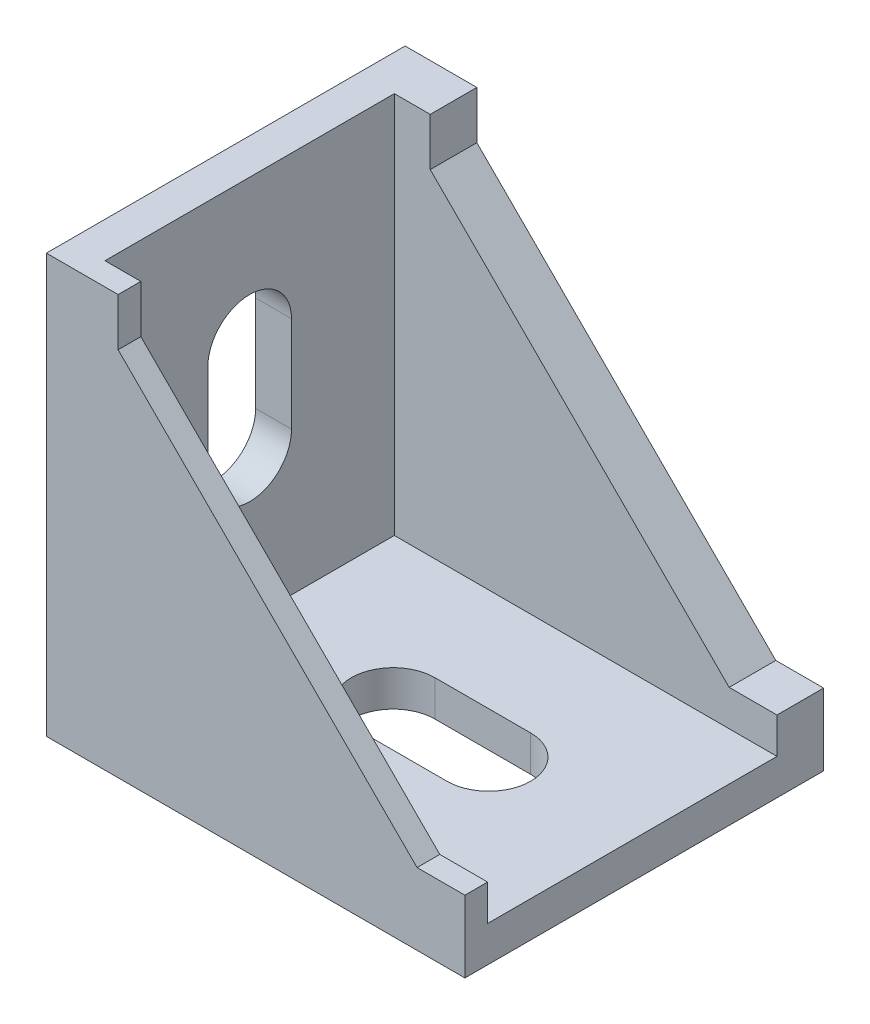
from build123d import *

# Parameters (mm, degrees)
BOSS_EXTRUDE1_DEPTH     = 15
CUT_EXTRUDE1_START      = -7
CUT_EXTRUDE1_DEPTH      = 6.05
CUT_EXTRUDE2_DEPTH      = 29.057975693
CUT_EXTRUDE2_DEPTH_BACK = 29.057975693
CUT_EXTRUDE3_DEPTH      = 29.057975693
CUT_EXTRUDE3_DEPTH_BACK = 29.057975693


with BuildPart() as part:
    # Sketch1 → Boss-Extrude1 (new body)
    with BuildSketch(Plane.XY):
        Polygon((0, 17.5), (0, 0), (17.5, 0), (17.5, 3), (15.5, 3), (3, 15.5), (3, 17.5), align=None)
    extrude(amount=-BOSS_EXTRUDE1_DEPTH)

    # Sketch4 → Cut-Extrude1 (cut, symmetric)
    with BuildSketch(Plane.XY.offset(CUT_EXTRUDE1_START)):
        Polygon((1.5, 17.5), (1.5, 1.5), (17.5, 1.5), (17.5, 3), (3, 17.5), align=None)
    extrude(amount=CUT_EXTRUDE1_DEPTH, both=True, mode=Mode.SUBTRACT)

    # Sketch5 → Cut-Extrude2 (cut, two sides: drawn at the far end of the back side and taken through both)
    with BuildSketch(Plane(origin=(0, 1.5, 0), x_dir=(1, 0, 0), z_dir=(0, 1, 0)).offset(-CUT_EXTRUDE2_DEPTH_BACK)):
        with BuildLine():
            Line((7.5, 8.75), (11.5, 8.75))
            ThreePointArc((11.5, 8.75), (13.25, 7), (11.5, 5.25))
            Line((11.5, 5.25), (7.5, 5.25))
            ThreePointArc((7.5, 5.25), (5.75, 7), (7.5, 8.75))
        make_face()
    extrude(amount=CUT_EXTRUDE2_DEPTH + CUT_EXTRUDE2_DEPTH_BACK, mode=Mode.SUBTRACT)

    # Sketch6 → Cut-Extrude3 (cut, two sides: drawn at the far end of the back side and taken through both)
    with BuildSketch(Plane(origin=(1.5, 0, 0), x_dir=(0, 0, -1), z_dir=(1, 0, 0)).offset(-CUT_EXTRUDE3_DEPTH_BACK)):
        with BuildLine():
            Line((5.25, 7.5), (5.25, 11.5))
            ThreePointArc((5.25, 11.5), (7, 13.25), (8.75, 11.5))
            Line((8.75, 11.5), (8.75, 7.5))
            ThreePointArc((8.75, 7.5), (7, 5.75), (5.25, 7.5))
        make_face()
    extrude(amount=CUT_EXTRUDE3_DEPTH + CUT_EXTRUDE3_DEPTH_BACK, mode=Mode.SUBTRACT)


solid = part.part
